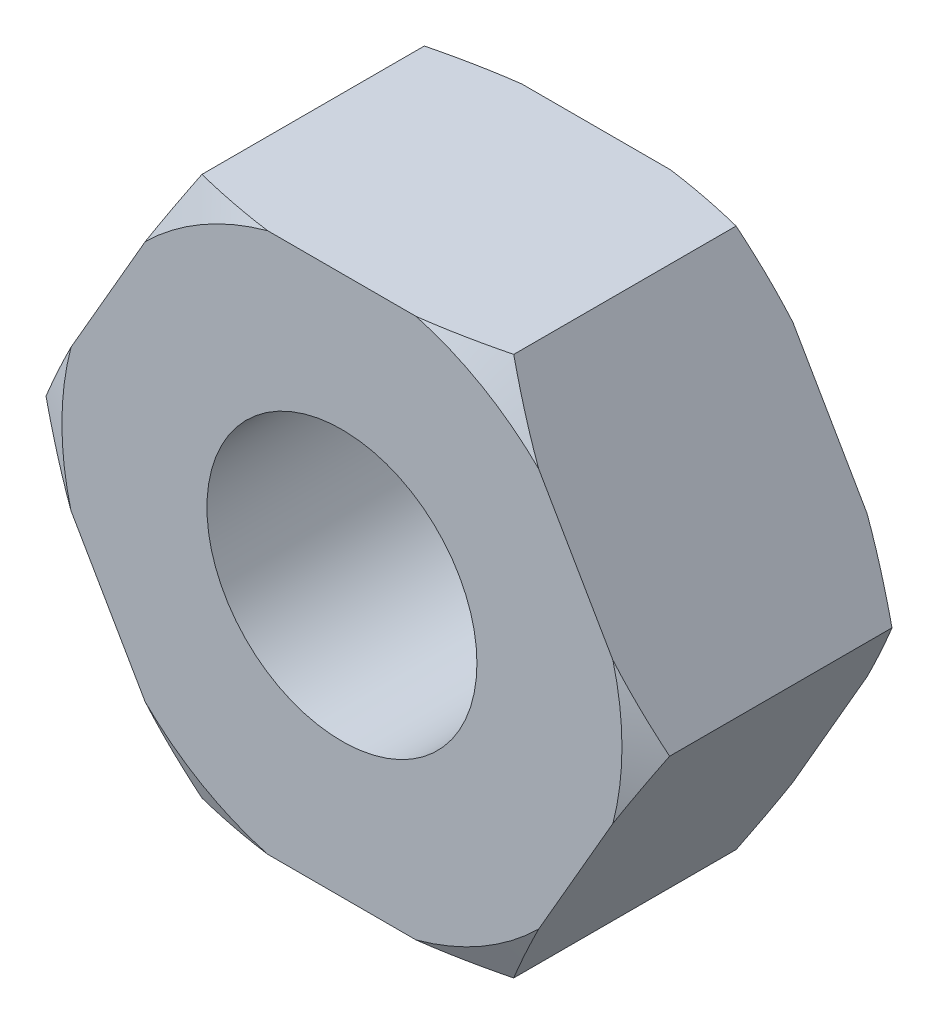
from build123d import *

# Parameters (mm, degrees)
IZIM1_R                     = 4.25
Y_KSEKLIK_EKSTR_ZYON1_DEPTH = 8


with BuildPart() as part:
    # Çizim1 → Yükseklik-Ekstrüzyon1 (new body)
    with BuildSketch(Plane.XY):
        Polygon((9.814954576, 0), (4.907477288, 8.5), (-4.907477288, 8.5), (-9.814954576, 0), (-4.907477288, -8.5), (4.907477288, -8.5), align=None)
        Circle(IZIM1_R, mode=Mode.SUBTRACT)
    extrude(amount=Y_KSEKLIK_EKSTR_ZYON1_DEPTH)

    # Çizim2 → Kes-Döndür1 (revolve, cut)
    with BuildSketch(Plane(origin=(0, 0, 0), x_dir=(1, 0, 0), z_dir=(0, 1, 0))):
        Polygon((-9.814954576, 0), (-8.814954576, 0), (-9.814954576, -0.5), align=None)
        Polygon((-9.814954576, -8), (-9.814954576, -7.5), (-8.814954576, -8), align=None)
    revolve(axis=Axis((0, 0, 0), (0, 0, 1)), mode=Mode.SUBTRACT)


solid = part.part
